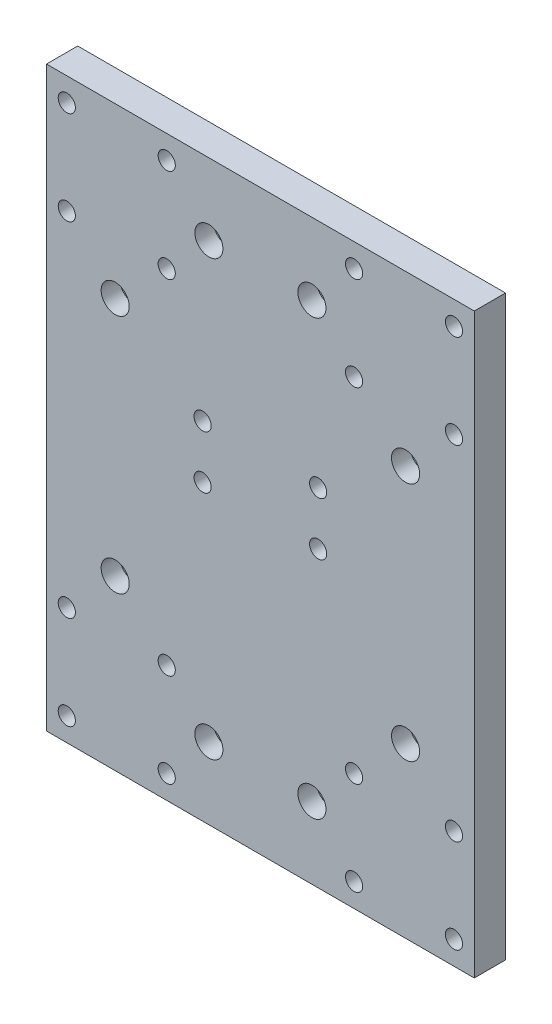
from build123d import *

# Parameters (mm, degrees)
SZKIC1_W                                             = 137
SZKIC1_H                                             = 185
DODANIE_WYCI_GNI_CIE1_DEPTH                          = 10
POG_BIENIE_WALCOWE_POD_M5_WKR_T_DO_CZ_CI_D           = 5.5
POG_BIENIE_WALCOWE_POD_M5_WKR_T_DO_CZ_CI_CBORE_D     = 9
POG_BIENIE_WALCOWE_POD_M5_WKR_T_DO_CZ_CI_CBORE_DEPTH = 6
POG_BIENIE_WALCOWE_POD_M5_WKR_T_DO_C_2_D             = 5.5
POG_BIENIE_WALCOWE_POD_M5_WKR_T_DO_C_2_CBORE_D       = 9
POG_BIENIE_WALCOWE_POD_M5_WKR_T_DO_C_2_CBORE_DEPTH   = 6
POG_BIENIE_WALCOWE_POD_M5_WKR_T_DO_C_3_D             = 5.5
POG_BIENIE_WALCOWE_POD_M5_WKR_T_DO_C_3_CBORE_D       = 9
POG_BIENIE_WALCOWE_POD_M5_WKR_T_DO_C_3_CBORE_DEPTH   = 6


with BuildPart() as part:
    # Szkic1 → Dodanie-wyciągnięcie1 (new body)
    with BuildSketch(Plane.XY):
        with Locations((68.5, 92.5)):
            Rectangle(SZKIC1_W, SZKIC1_H)
    extrude(amount=DODANIE_WYCI_GNI_CIE1_DEPTH)

    # Pog_bienie walcowe pod M5 Wkr_t do cz_ci (through all)
    with Locations(Plane(origin=(0, 0, 0), x_dir=(-1, 0, 0), z_dir=(0, 0, -1))):
        with Locations((-38.5, 177.5), (-6.5, 177.5), (-38.5, 147.5), (-6.5, 147.5), (-38.5, 37.5), (-6.5, 37.5), (-38.5, 7.5), (-6.5, 7.5), (-130.5, 7.5), (-98.5, 7.5), (-130.5, 37.5), (-98.5, 37.5), (-130.5, 147.5), (-98.5, 147.5), (-130.5, 177.5), (-98.5, 177.5)):
            CounterBoreHole(POG_BIENIE_WALCOWE_POD_M5_WKR_T_DO_CZ_CI_D / 2, POG_BIENIE_WALCOWE_POD_M5_WKR_T_DO_CZ_CI_CBORE_D / 2, POG_BIENIE_WALCOWE_POD_M5_WKR_T_DO_CZ_CI_CBORE_DEPTH)

    # Pog_bienie walcowe pod M5 Wkr_t do c 2 (through all)
    with Locations(Plane.XY.offset(10)):
        with Locations((52, 162), (22, 131), (22, 54), (52, 23), (85, 23), (115, 54), (115, 131), (85, 162)):
            CounterBoreHole(POG_BIENIE_WALCOWE_POD_M5_WKR_T_DO_C_2_D / 2, POG_BIENIE_WALCOWE_POD_M5_WKR_T_DO_C_2_CBORE_D / 2, POG_BIENIE_WALCOWE_POD_M5_WKR_T_DO_C_2_CBORE_DEPTH)

    # Pog_bienie walcowe pod M5 Wkr_t do c 3 (through all)
    with Locations(Plane(origin=(0, 0, 0), x_dir=(-1, 0, 0), z_dir=(0, 0, -1))):
        with Locations((-87, 111), (-50, 111), (-87, 94), (-50, 94)):
            CounterBoreHole(POG_BIENIE_WALCOWE_POD_M5_WKR_T_DO_C_3_D / 2, POG_BIENIE_WALCOWE_POD_M5_WKR_T_DO_C_3_CBORE_D / 2, POG_BIENIE_WALCOWE_POD_M5_WKR_T_DO_C_3_CBORE_DEPTH)


solid = part.part
